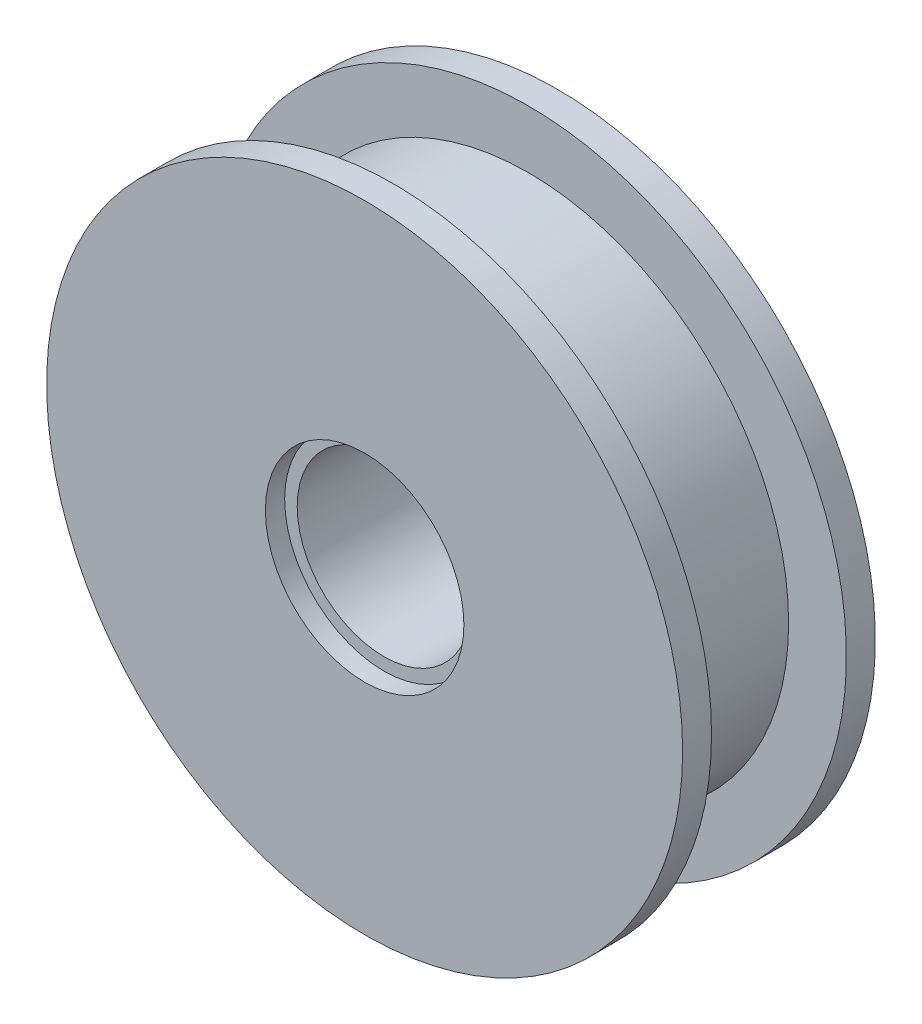
from build123d import *

# Parameters (mm, degrees)
SKETCH1_R           = 13.5
SKETCH1_R_2         = 4.5
BOSS_EXTRUDE1_DEPTH = 10
SKETCH2_R           = 5.15
CUT_EXTRUDE1_DEPTH  = 1
CUT_EXTRUDE2_START  = -1
SKETCH3_R           = 5.15
CUT_EXTRUDE2_DEPTH  = 1
BOSS_EXTRUDE2_START = -1.5
SKETCH4_R           = 16.5
SKETCH4_R_2         = 5.15
BOSS_EXTRUDE2_DEPTH = 1.5
SKETCH5_R           = 16.5
SKETCH5_R_2         = 5.15
BOSS_EXTRUDE3_DEPTH = 1.5


with BuildPart() as part:
    # Sketch1 → Boss-Extrude1 (new body)
    with BuildSketch(Plane.XY):
        Circle(SKETCH1_R)
        Circle(SKETCH1_R_2, mode=Mode.SUBTRACT)
    extrude(amount=BOSS_EXTRUDE1_DEPTH)

    # Sketch2 → Cut-Extrude1 (cut)
    with BuildSketch(Plane.XY.offset(10)):
        Circle(SKETCH2_R)
    extrude(amount=-CUT_EXTRUDE1_DEPTH, mode=Mode.SUBTRACT)

    # Sketch3 → Cut-Extrude2 (cut)
    with BuildSketch(Plane(origin=(0, 0, 0), x_dir=(-1, 0, 0), z_dir=(0, 0, -1)).offset(CUT_EXTRUDE2_START)):
        with Locations(Location((0, 0, 0), (0, 0, 180))):
            Circle(SKETCH3_R)
    extrude(amount=CUT_EXTRUDE2_DEPTH, mode=Mode.SUBTRACT)

    # Sketch4 → Boss-Extrude2 (add)
    with BuildSketch(Plane(origin=(0, 0, 0), x_dir=(-1, 0, 0), z_dir=(0, 0, -1)).offset(BOSS_EXTRUDE2_START)):
        Circle(SKETCH4_R)
        with Locations(Location((0, 0, 0), (0, 0, 180))):
            Circle(SKETCH4_R_2, mode=Mode.SUBTRACT)
    extrude(amount=BOSS_EXTRUDE2_DEPTH)

    # Sketch5 → Boss-Extrude3 (add)
    with BuildSketch(Plane.XY.offset(10)):
        with Locations(Location((0, 0, 0), (0, 0, 180))):
            Circle(SKETCH5_R)
        Circle(SKETCH5_R_2, mode=Mode.SUBTRACT)
    extrude(amount=-BOSS_EXTRUDE3_DEPTH)


solid = part.part
